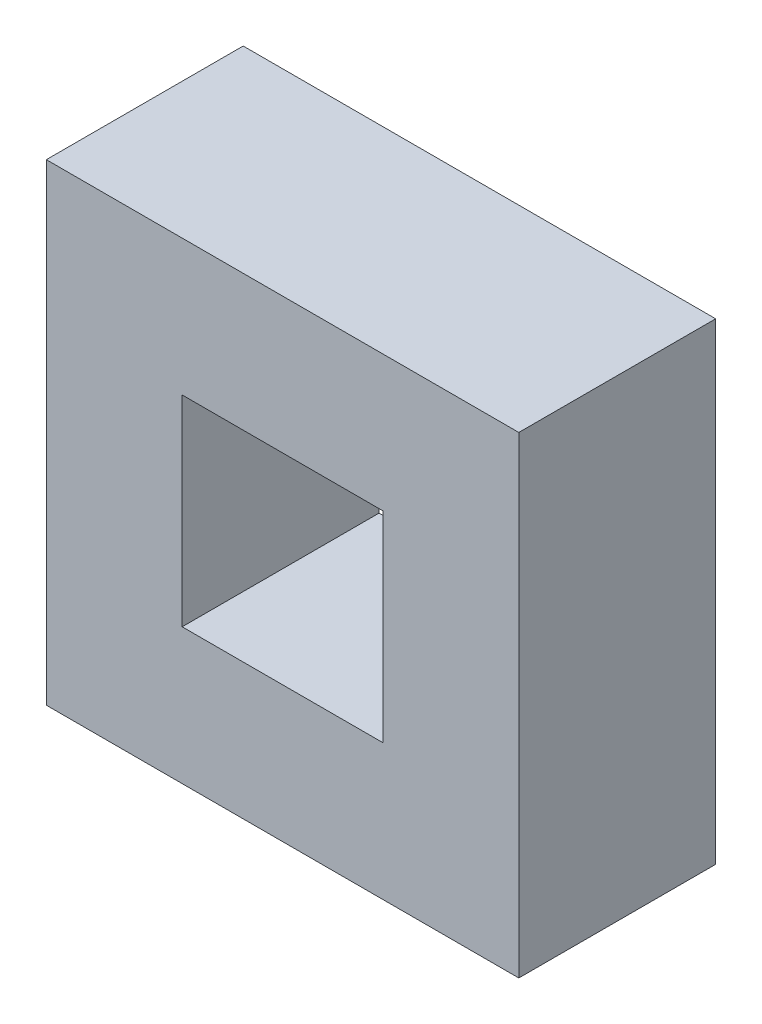
from build123d import *

# Parameters (mm, degrees)
SKETCH_1_W      = 120
SKETCH_1_H      = 120
SKETCH_1_W_2    = 51
SKETCH_1_H_2    = 51
EXTRUDE_1_DEPTH = 50


with BuildPart() as part:
    # 스케치1 → 보스-돌출1 (new body)
    with BuildSketch(Plane.XY):
        Rectangle(SKETCH_1_W, SKETCH_1_H)
        Rectangle(SKETCH_1_W_2, SKETCH_1_H_2, mode=Mode.SUBTRACT)
    extrude(amount=EXTRUDE_1_DEPTH)


solid = part.part
